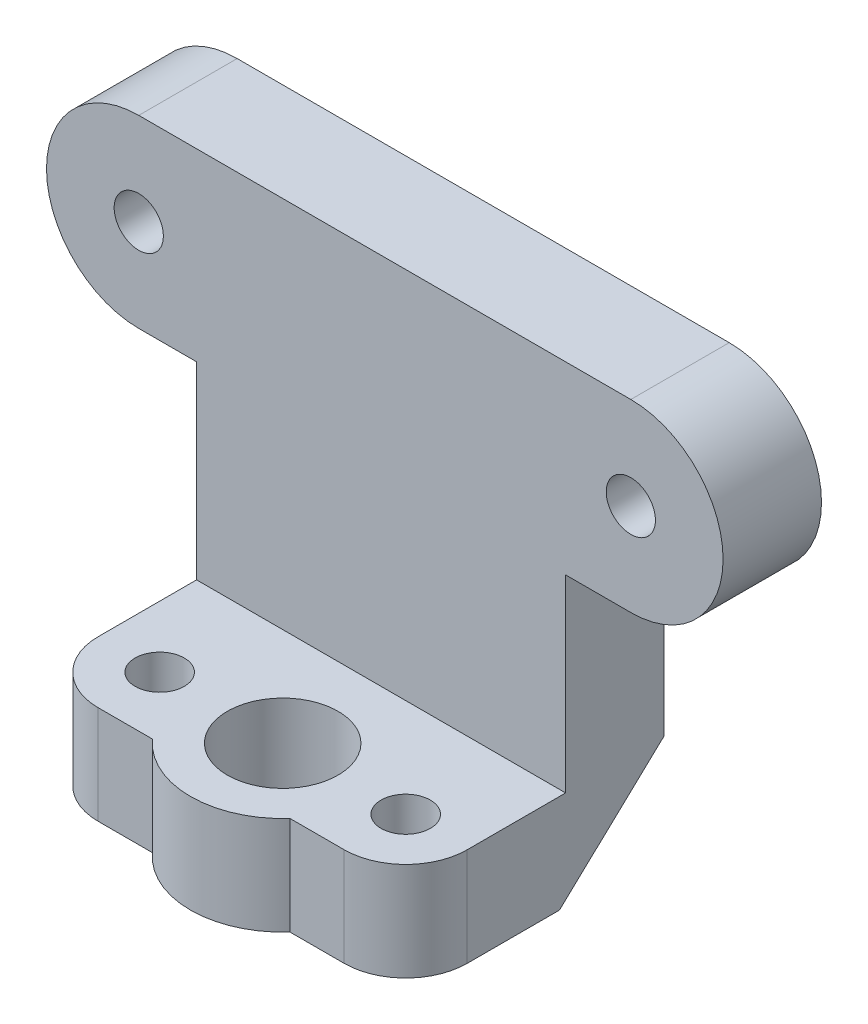
from build123d import *

# Parameters (mm, degrees)
SKETCH1_R           = 2
BOSS_EXTRUDE1_DEPTH = 8
SKETCH2_R           = 7.5
SKETCH2_R_2         = 4.5
BOSS_EXTRUDE2_DEPTH = 8
SKETCH3_R           = 2
BOSS_EXTRUDE3_DEPTH = 8
SKETCH8_W           = 30
SKETCH8_H           = 8
BOSS_EXTRUDE7_DEPTH = 15.35
BOSS_EXTRUDE8_DEPTH = 30
BOSS_EXTRUDE9_DEPTH = 8


with BuildPart() as part:
    # Sketch1 → Boss-Extrude1 (new body)
    with BuildSketch(Plane.XY):
        with BuildLine():
            Line((134.5, -11.9), (174.5, -11.9))
            ThreePointArc((174.5, -11.9), (182, -19.4), (174.5, -26.9))
            Line((174.5, -26.9), (134.5, -26.9))
            ThreePointArc((134.5, -26.9), (127, -19.4), (134.5, -11.9))
        make_face()
        with Locations((134.5, -19.4)):
            Circle(SKETCH1_R, mode=Mode.SUBTRACT)
        with Locations((174.5, -19.4)):
            Circle(SKETCH1_R, mode=Mode.SUBTRACT)
    extrude(amount=BOSS_EXTRUDE1_DEPTH)

    # Sketch8 → Boss-Extrude7 (add)
    with BuildSketch(Plane(origin=(0, -26.9, 0), x_dir=(-1, 0, 0), z_dir=(0, -1, 0))):
        with Locations((-154.2, -4)):
            Rectangle(SKETCH8_W, SKETCH8_H)
    extrude(amount=BOSS_EXTRUDE7_DEPTH)



with BuildPart() as body_2:
    # Sketch2 → Boss-Extrude2 (new body)
    with BuildSketch(Plane(origin=(0, -42.25, 0), x_dir=(1, 0, 0), z_dir=(0, 1, 0))):
        with Locations(Location((154.2, -16, 0), (0, 0, 270))):
            Circle(SKETCH2_R)
        with Locations(Location((154.2, -16, 0), (0, 0, 270))):
            Circle(SKETCH2_R_2, mode=Mode.SUBTRACT)
    extrude(amount=-BOSS_EXTRUDE2_DEPTH)

    # Sketch3 → Boss-Extrude3 (add)
    # profile 1 of 2: a face of its own
    with BuildSketch(Plane(origin=(0, -42.25, 0), x_dir=(1, 0, 0), z_dir=(0, 1, 0))):
        with BuildLine():
            Line((144.2, -11), (148.609830056, -11))
            ThreePointArc((148.609830056, -11), (146.7, -16), (148.609830056, -21))
            Line((148.609830056, -21), (144.2, -21))
            ThreePointArc((144.2, -21), (139.2, -16), (144.2, -11))
        make_face()
        with Locations(Location((144.2, -16, 0), (0, 0, 270))):
            Circle(SKETCH3_R, mode=Mode.SUBTRACT)
    # profile 2 of 2: a face of its own
    with BuildSketch(Plane(origin=(0, -42.25, 0), x_dir=(1, 0, 0), z_dir=(0, 1, 0))):
        with BuildLine():
            Line((164.2, -21), (159.790169944, -21))
            ThreePointArc((159.790169944, -21), (161.7, -16), (159.790169944, -11))
            Line((159.790169944, -11), (164.2, -11))
            ThreePointArc((164.2, -11), (169.2, -16), (164.2, -21))
        make_face()
        with Locations(Location((164.2, -16, 0), (0, 0, 90))):
            Circle(SKETCH3_R, mode=Mode.SUBTRACT)
    extrude(amount=-BOSS_EXTRUDE3_DEPTH)


with BuildPart() as part_1:
    add(part.part)

    add(body_2.part)  # Boss-Extrude8 merges body 2
    # Sketch9 → Boss-Extrude8 (add)
    with BuildSketch(Plane(origin=(169.2, 0, 0), x_dir=(0, 0, -1), z_dir=(1, 0, 0))):
        Polygon((-11, -50.25), (-8.5, -50.25), (0, -42.25), (-8, -42.25), (-11, -42.25), align=None)
    extrude(amount=-BOSS_EXTRUDE8_DEPTH)

    # Sketch10 → Boss-Extrude9 (add, through all)
    with BuildSketch(Plane(origin=(0, -42.25, 0), x_dir=(1, 0, 0), z_dir=(0, 1, 0))):
        with BuildLine():
            Line((139.2, -11), (139.2, -16))
            ThreePointArc((139.2, -16), (140.664466094, -12.464466094), (144.2, -11))
            Line((144.2, -11), (139.2, -11))
        make_face()
        with BuildLine():
            Line((169.2, -11), (164.2, -11))
            ThreePointArc((164.2, -11), (167.735533906, -12.464466094), (169.2, -16))
            Line((169.2, -16), (169.2, -11))
        make_face()
    extrude(amount=-BOSS_EXTRUDE9_DEPTH)


solid = part_1.part
